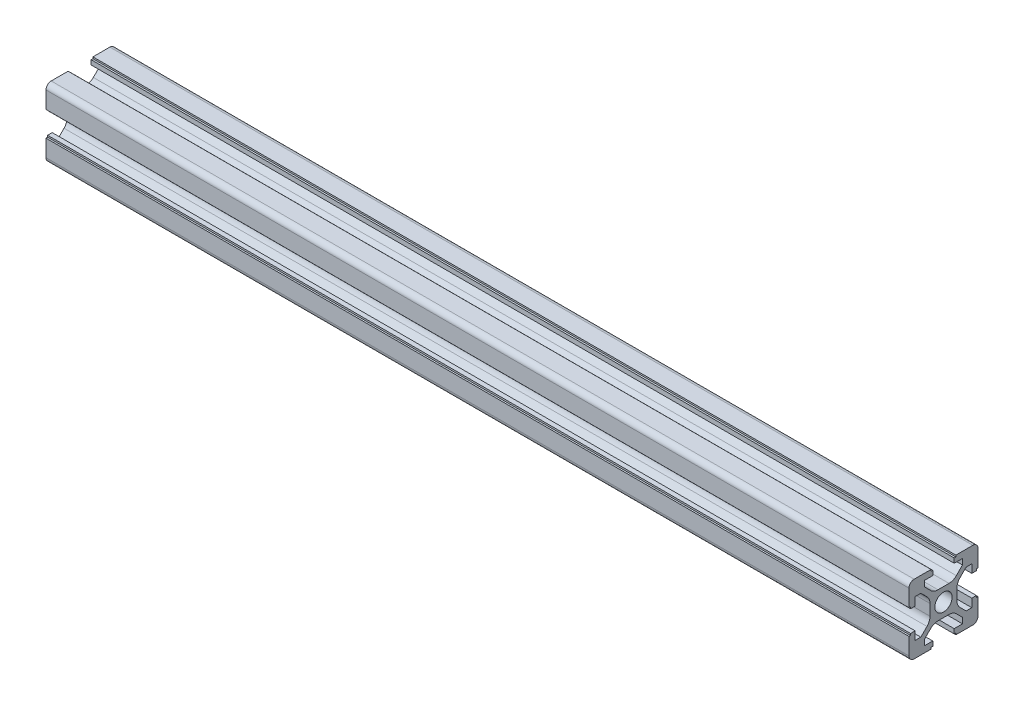
from build123d import *

# Parameters (mm, degrees)
EXTRUDE_1_DEPTH = 250
FILLET_1_R      = 1.5
FILLET_2_R      = 3


with BuildPart() as part:
    # 草图1 → 凸台-拉伸1 (new body)
    with BuildSketch(Plane(origin=(0, 0, 0), x_dir=(0, 0, -1), z_dir=(1, 0, 0))):
        Polygon((-10, 10), (-10, 3.6), (-9.530955747, 3.6), (-9.530955747, 3.1), (-8.2, 3.1), (-8.2, 5.5), (-6.560660172, 5.5), (-3.9, 2.839339828), (-3.9, 0), (-3.9, -2.839339828), (-6.560660172, -5.5), (-8.2, -5.5), (-8.2, -3.1), (-9.530955747, -3.1), (-9.530955747, -3.6), (-10, -3.6), (-10, -10), (-3.6, -10), (-3.6, -9.530955747), (-3.1, -9.530955747), (-3.1, -8.2), (-5.5, -8.2), (-5.5, -6.560660172), (-2.839339828, -3.9), (0, -3.9), (2.839339828, -3.9), (5.5, -6.560660172), (5.5, -8.2), (3.1, -8.2), (3.1, -9.530955747), (3.6, -9.530955747), (3.6, -10), (10, -10), (10, -3.6), (9.530955747, -3.6), (9.530955747, -3.1), (8.2, -3.1), (8.2, -5.5), (6.560660172, -5.5), (3.9, -2.839339828), (3.9, 0), (3.9, 2.839339828), (6.560660172, 5.5), (8.2, 5.5), (8.2, 3.1), (9.530955747, 3.1), (9.530955747, 3.6), (10, 3.6), (10, 10), (3.6, 10), (3.6, 9.530955747), (3.1, 9.530955747), (3.1, 8.2), (5.5, 8.2), (5.5, 6.560660172), (2.839339828, 3.9), (0, 3.9), (-2.839339828, 3.9), (-5.5, 6.560660172), (-5.5, 8.2), (-3.1, 8.2), (-3.1, 9.530955747), (-3.6, 9.530955747), (-3.6, 10), align=None)
        with BuildLine():
            ThreePointArc((0, 2.5), (-1.767766953, 1.767766953), (-2.5, 0))
            ThreePointArc((-2.5, 0), (-1.767766953, -1.767766953), (0, -2.5))
            ThreePointArc((0, -2.5), (1.767766953, -1.767766953), (2.5, 0))
            ThreePointArc((2.5, 0), (1.767766953, 1.767766953), (0, 2.5))
        make_face(mode=Mode.SUBTRACT)
    extrude(amount=EXTRUDE_1_DEPTH)

    # 圆角1
    fillet_1_edges = [part.edges().sort_by_distance(p)[0] for p in [
        (125, -10, -10),
        (125, -10, 10),
        (125, 10, 10),
        (125, 10, -10),
    ]]
    fillet(fillet_1_edges, radius=FILLET_1_R)

    # 圆角2
    fillet_2_edges = [part.edges().sort_by_distance(p)[0] for p in [
        (125, -3.9, -2.839339828),
        (125, -3.9, 2.839339828),
        (125, -2.839339828, 3.9),
        (125, 2.839339828, 3.9),
        (125, 3.9, 2.839339828),
        (125, 3.9, -2.839339828),
        (125, 2.839339828, -3.9),
        (125, -2.839339828, -3.9),
    ]]
    fillet(fillet_2_edges, radius=FILLET_2_R)


solid = part.part
